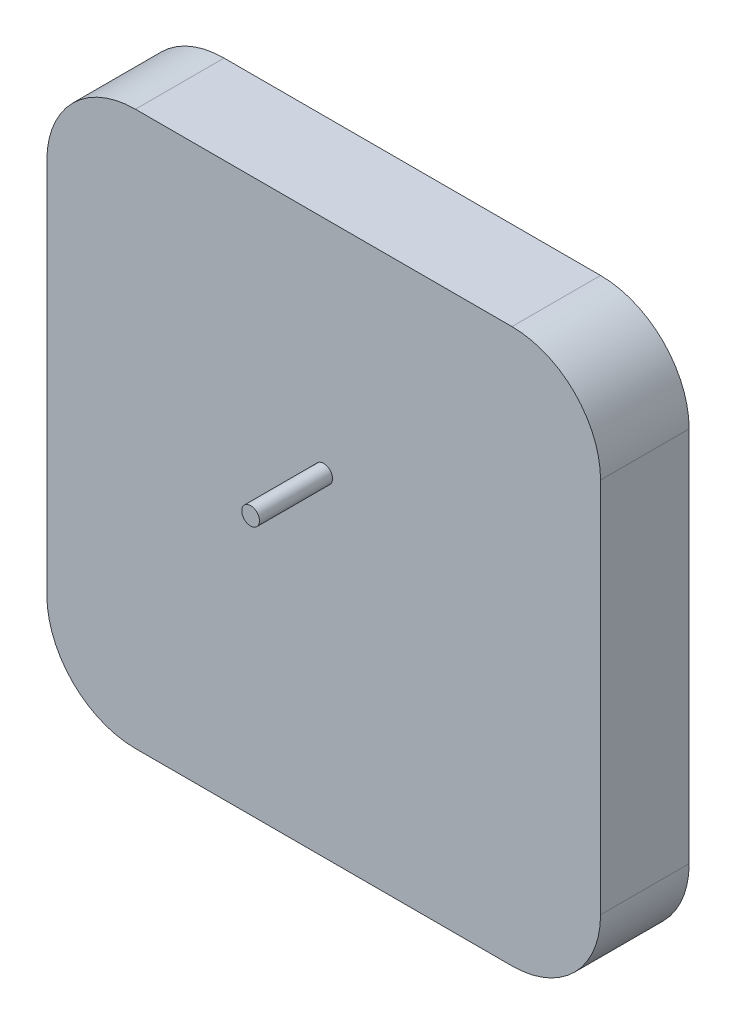
from build123d import *

# Parameters (mm, degrees)
EXTRUDE_1_DEPTH = 4
SKETCH_2_R      = 0.4
EXTRUDE_2_DEPTH = 3.3
SKETCH_3_R      = 1.5
EXTRUDE_3_DEPTH = 0.7


with BuildPart() as part:
    # Эскиз1 → Бобышка-Вытянуть1 (new body)
    with BuildSketch(Plane.XY):
        with BuildLine():
            Line((-8.5, 12.5), (8.5, 12.5))
            ThreePointArc((8.5, 12.5), (11.328427125, 11.328427125), (12.5, 8.5))
            Line((12.5, 8.5), (12.5, -8.5))
            ThreePointArc((12.5, -8.5), (11.328427125, -11.328427125), (8.5, -12.5))
            Line((8.5, -12.5), (-8.5, -12.5))
            ThreePointArc((-8.5, -12.5), (-11.328427125, -11.328427125), (-12.5, -8.5))
            Line((-12.5, -8.5), (-12.5, 8.5))
            ThreePointArc((-12.5, 8.5), (-11.328427125, 11.328427125), (-8.5, 12.5))
        make_face()
    extrude(amount=EXTRUDE_1_DEPTH)

    # Эскиз2 → Бобышка-Вытянуть2 (add)
    with BuildSketch(Plane.XY.offset(4)):
        with Locations((0, 2.5)):
            Circle(SKETCH_2_R)
    extrude(amount=EXTRUDE_2_DEPTH)

    # Эскиз3 → Бобышка-Вытянуть3 (add)
    with BuildSketch(Plane(origin=(0, 0, 0), x_dir=(-1, 0, 0), z_dir=(0, 0, -1))):
        with Locations(Location((0, 2.5, 0), (0, 0, 180))):
            Circle(SKETCH_3_R)
    extrude(amount=EXTRUDE_3_DEPTH)


solid = part.part
